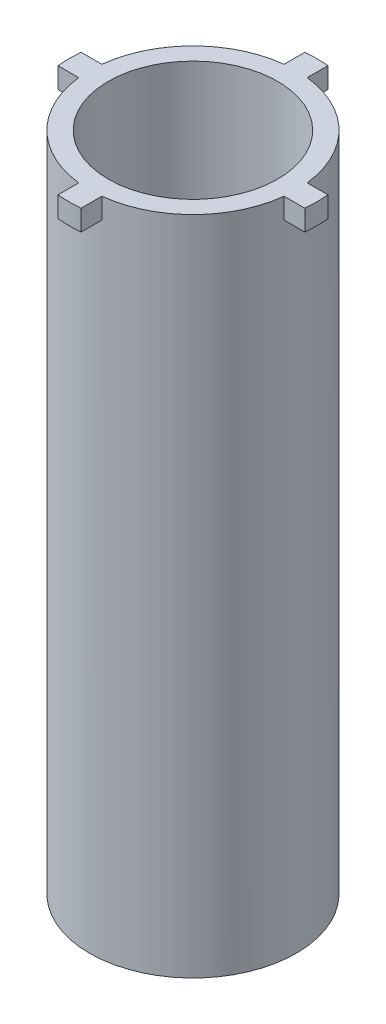
from build123d import *

# Parameters (mm, degrees)
BOSS_EXTRUDE1_DEPTH   = 2.5
BOSS_EXTRUDE1_2_DEPTH = 2.5
BOSS_EXTRUDE1_3_DEPTH = 2.5
BOSS_EXTRUDE1_4_DEPTH = 2.5
SKETCH1_3_R           = 10.25
BOSS_EXTRUDE2_DEPTH   = 80


with BuildPart() as part:
    # Sketch1 → Boss-Extrude1 (new body)
    with BuildSketch(Plane(origin=(0, 0, 0), x_dir=(1, 0, 0), z_dir=(0, 1, 0))):
        with BuildLine():
            ThreePointArc((-1.4, 12.421352583), (0, 12.5), (1.4, 12.421352583))
            Line((1.4, 12.421352583), (1.4, 14.934523762))
            ThreePointArc((1.4, 14.934523762), (0, 15), (-1.4, 14.934523762))
            Line((-1.4, 14.934523762), (-1.4, 12.421352583))
        make_face()
    extrude(amount=-BOSS_EXTRUDE1_DEPTH)



with BuildPart() as body_2:
    # Sketch1 → Boss-Extrude1 2 (new body)
    with BuildSketch(Plane(origin=(0, 0, 0), x_dir=(1, 0, 0), z_dir=(0, 1, 0))):
        with BuildLine():
            Line((14.934523762, 1.4), (12.421352583, 1.4))
            ThreePointArc((12.421352583, 1.4), (12.5, 0), (12.421352583, -1.4))
            Line((12.421352583, -1.4), (14.934523762, -1.4))
            ThreePointArc((14.934523762, -1.4), (15, 0), (14.934523762, 1.4))
        make_face()
    extrude(amount=-BOSS_EXTRUDE1_2_DEPTH)


with BuildPart() as body_3:
    # Sketch1 → Boss-Extrude1 3 (new body)
    with BuildSketch(Plane(origin=(0, 0, 0), x_dir=(1, 0, 0), z_dir=(0, 1, 0))):
        with BuildLine():
            ThreePointArc((-12.421352583, -1.4), (-12.5, 0), (-12.421352583, 1.4))
            Line((-12.421352583, 1.4), (-14.934523762, 1.4))
            ThreePointArc((-14.934523762, 1.4), (-15, 0), (-14.934523762, -1.4))
            Line((-14.934523762, -1.4), (-12.421352583, -1.4))
        make_face()
    extrude(amount=-BOSS_EXTRUDE1_3_DEPTH)


with BuildPart() as body_4:
    # Sketch1 → Boss-Extrude1 4 (new body)
    with BuildSketch(Plane(origin=(0, 0, 0), x_dir=(1, 0, 0), z_dir=(0, 1, 0))):
        with BuildLine():
            Line((1.4, -14.934523762), (1.4, -12.421352583))
            ThreePointArc((1.4, -12.421352583), (0, -12.5), (-1.4, -12.421352583))
            Line((-1.4, -12.421352583), (-1.4, -14.934523762))
            ThreePointArc((-1.4, -14.934523762), (0, -15), (1.4, -14.934523762))
        make_face()
    extrude(amount=-BOSS_EXTRUDE1_4_DEPTH)


with BuildPart() as part_1:
    add(part.part)

    add(body_2.part)  # Boss-Extrude2 merges body 2

    add(body_3.part)  # Boss-Extrude2 merges body 3

    add(body_4.part)  # Boss-Extrude2 merges body 4
    # Sketch1<3> → Boss-Extrude2 (add)
    with BuildSketch(Plane(origin=(0, 0, 0), x_dir=(1, 0, 0), z_dir=(0, 1, 0))):
        with BuildLine():
            ThreePointArc((12.421352583, 1.4), (8.838834765, 8.838834765), (1.4, 12.421352583))
            ThreePointArc((1.4, 12.421352583), (0, 12.5), (-1.4, 12.421352583))
            ThreePointArc((-1.4, 12.421352583), (-8.838834765, 8.838834765), (-12.421352583, 1.4))
            ThreePointArc((-12.421352583, 1.4), (-12.5, 0), (-12.421352583, -1.4))
            ThreePointArc((-12.421352583, -1.4), (-8.838834765, -8.838834765), (-1.4, -12.421352583))
            ThreePointArc((-1.4, -12.421352583), (0, -12.5), (1.4, -12.421352583))
            ThreePointArc((1.4, -12.421352583), (8.838834765, -8.838834765), (12.421352583, -1.4))
            ThreePointArc((12.421352583, -1.4), (12.480322658, -0.701103669), (12.5, 0))
            ThreePointArc((12.5, 0), (12.480322658, 0.701103669), (12.421352583, 1.4))
        make_face()
        Circle(SKETCH1_3_R, mode=Mode.SUBTRACT)
    extrude(amount=-BOSS_EXTRUDE2_DEPTH)


solid = part_1.part
